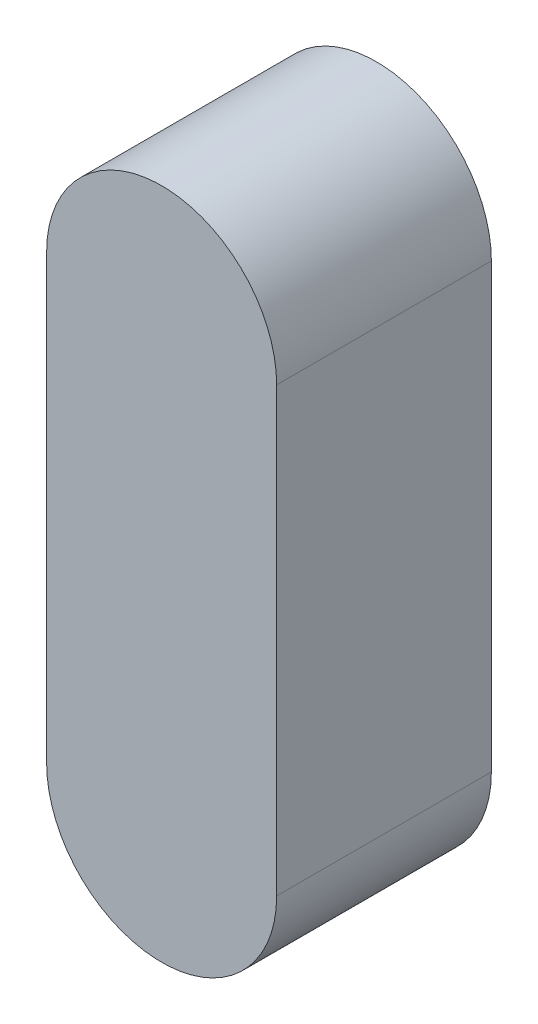
from build123d import *

# Parameters (mm, degrees)
STEM_BLOCK_EXTRUDE_DEPTH      = 65
STEM_BLOCK_EXTRUDE_DEPTH_BACK = 65


with BuildPart() as part:
    # Stem Block Sketch → Stem Block Extrude (new, two sides: drawn at the far end of the back side and taken through both)
    with BuildSketch(Plane.XY.offset(-STEM_BLOCK_EXTRUDE_DEPTH_BACK)):
        with BuildLine():
            Line((-69.641282517, 0), (-69.641282517, 267.978036065))
            ThreePointArc((-69.641282517, 267.978036065), (0, 337.619318582), (69.641282517, 267.978036065))
            Line((69.641282517, 267.978036065), (69.641282517, 0))
            ThreePointArc((69.641282517, 0), (0, -69.641282517), (-69.641282517, 0))
        make_face()
    extrude(amount=STEM_BLOCK_EXTRUDE_DEPTH + STEM_BLOCK_EXTRUDE_DEPTH_BACK)


solid = part.part
